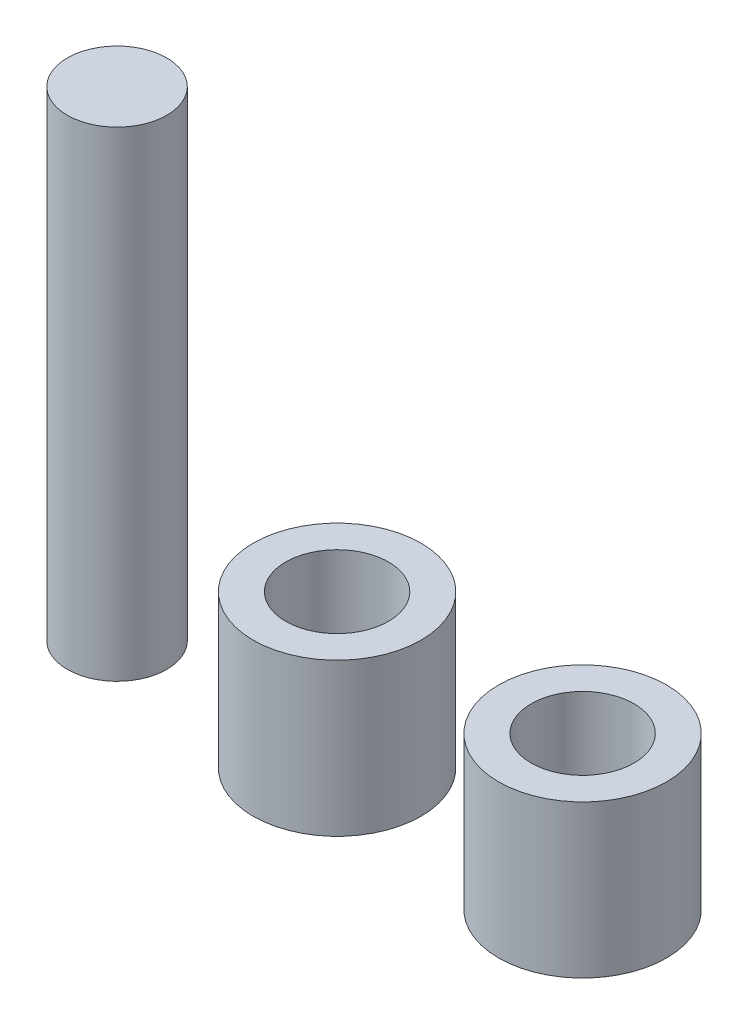
from build123d import *

# Parameters (mm, degrees)
SKETCH1_R           = 1.45
BOSS_EXTRUDE1_DEPTH = 14
SKETCH2_R           = 2.45
BOSS_EXTRUDE2_DEPTH = 4.45
SKETCH3_R           = 1.5
CUT_EXTRUDE1_DEPTH  = 14.261498167


with BuildPart() as part:
    # Sketch1 → Boss-Extrude1 (new body)
    with BuildSketch(Plane(origin=(0, 0, 0), x_dir=(1, 0, 0), z_dir=(0, 1, 0))):
        with Locations(Location((0, 0, 0), (0, 0, 270))):
            Circle(SKETCH1_R)
    extrude(amount=BOSS_EXTRUDE1_DEPTH)


with BuildPart() as body_2:
    # Sketch2 → Boss-Extrude2 (new body)
    with BuildSketch(Plane(origin=(0, 0, 0), x_dir=(1, 0, 0), z_dir=(0, 1, 0))):
        with Locations(Location((6.419178859, 0, 0), (0, 0, 270))):
            Circle(SKETCH2_R)
    extrude(amount=BOSS_EXTRUDE2_DEPTH)

    # Sketch3 → Cut-Extrude1 (cut, through all)
    with BuildSketch(Plane(origin=(0, 4.45, 0), x_dir=(1, 0, 0), z_dir=(0, 1, 0))):
        with Locations(Location((6.419178859, 0, 0), (0, 0, 270))):
            Circle(SKETCH3_R)
    extrude(amount=-CUT_EXTRUDE1_DEPTH, mode=Mode.SUBTRACT)


with BuildPart() as body_3:
    # Mirror23: mirrored copy
    add(body_2.part.mirror(Plane(origin=(10, 0, 0), x_dir=(0, 0, 1), z_dir=(1, 0, 0))))


solid = Compound([part.part, body_2.part, body_3.part])
